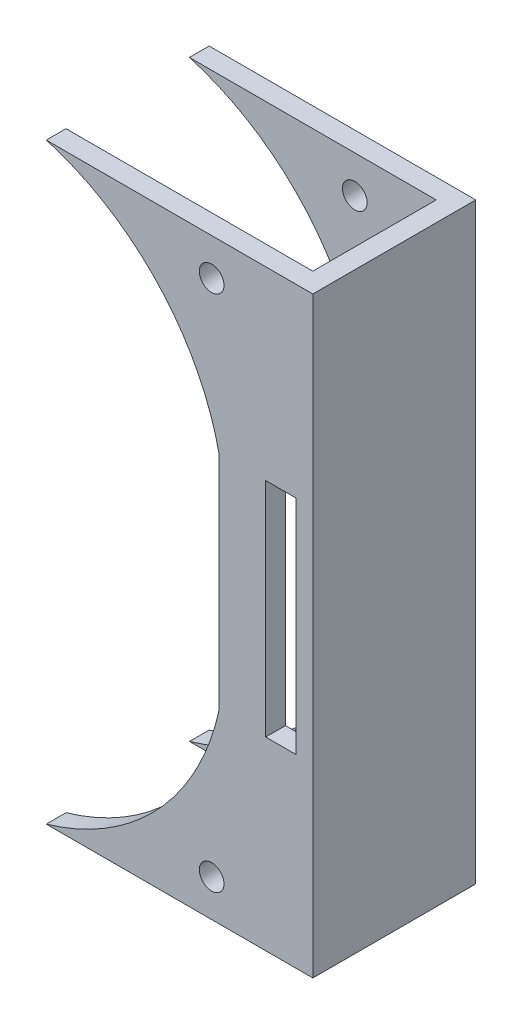
from build123d import *

# Parameters (mm, degrees)
SKETCH3_W           = 13
SKETCH3_H           = 120
BOSS_EXTRUDE1_DEPTH = 4
SKETCH11_W          = 33
SKETCH11_H          = 120
BOSS_EXTRUDE4_DEPTH = 4
SKETCH12_R          = 2.5
CUT_EXTRUDE3_DEPTH  = 76.305579191
SKETCH13_W          = 6.102814475
SKETCH13_H          = 45
CUT_EXTRUDE4_DEPTH  = 76.305579191


with BuildPart() as part:
    # Sketch3 → Boss-Extrude1 (new body)
    with BuildSketch(Plane.XY):
        with Locations((20.835766423, 0)):
            Rectangle(SKETCH3_W, SKETCH3_H)
        with BuildLine():
            Line((14.335766423, 0), (14.335766423, 60))
            Line((14.335766423, 60), (-22.664233577, 60))
            ThreePointArc((-22.664233577, 60), (-0.008037132, 46.062450015), (12.335766423, 22.5))
            Line((12.335766423, 22.5), (12.335766423, 0))
            Line((12.335766423, 0), (14.335766423, 0))
        make_face()
        with BuildLine():
            Line((14.335766423, -60), (14.335766423, 0))
            Line((14.335766423, 0), (12.335766423, 0))
            Line((12.335766423, 0), (12.335766423, -22.5))
            ThreePointArc((12.335766423, -22.5), (-0.008037132, -46.062450015), (-22.664233577, -60))
            Line((-22.664233577, -60), (14.335766423, -60))
        make_face()
    extrude(amount=BOSS_EXTRUDE1_DEPTH)


with BuildPart() as body_2:
    # Mirror4: mirrored copy
    add(part.part.mirror(Plane.XY.offset(-12.5)))


with BuildPart() as part_1:
    add(part.part)

    add(body_2.part)  # Boss-Extrude4 merges body 2
    # Sketch11 → Boss-Extrude4 (add)
    with BuildSketch(Plane(origin=(27.335766423, 0, 0), x_dir=(0, 0, -1), z_dir=(1, 0, 0))):
        with Locations((12.5, 0)):
            Rectangle(SKETCH11_W, SKETCH11_H)
    extrude(amount=BOSS_EXTRUDE4_DEPTH)

    # Sketch12 → Cut-Extrude3 (cut, through all)
    with BuildSketch(Plane.XY.offset(4)):
        with Locations((10.835766423, 52.5)):
            Circle(SKETCH12_R)
    cut_extrude3 = extrude(amount=-CUT_EXTRUDE3_DEPTH, mode=Mode.SUBTRACT)

    # Mirror5: Cut-Extrude3 across plane
    add(cut_extrude3.mirror(Plane.ZX), mode=Mode.SUBTRACT)

    # Sketch13 → Cut-Extrude4 (cut, through all)
    with BuildSketch(Plane.XY.offset(4)):
        with Locations((24.835766424, 0)):
            Rectangle(SKETCH13_W, SKETCH13_H)
    extrude(amount=-CUT_EXTRUDE4_DEPTH, mode=Mode.SUBTRACT)


solid = part_1.part
